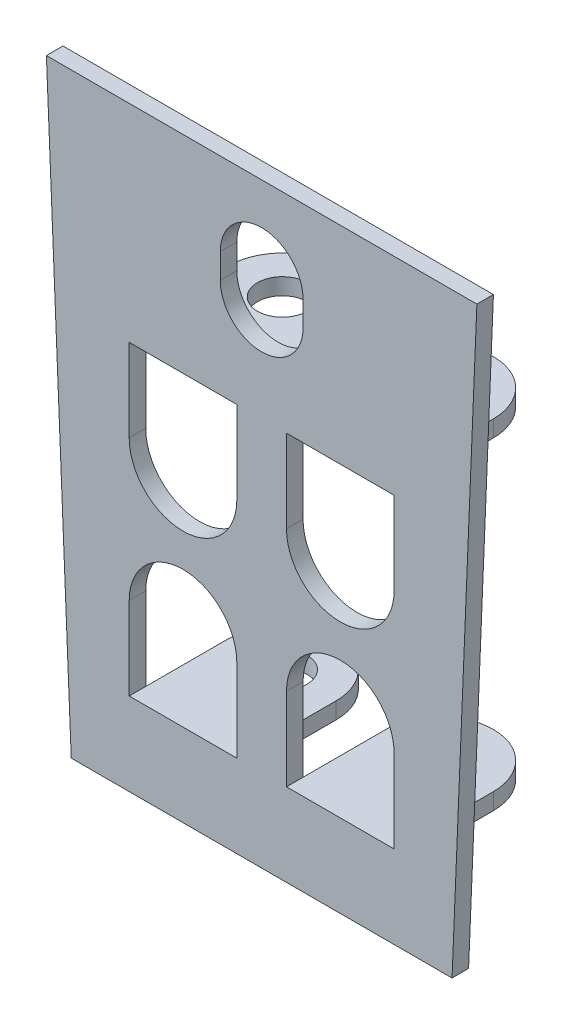
from build123d import *

# Parameters (mm, degrees)
EXTRUDE_1_DEPTH = 2
SKETCH_2_R      = 3
EXTRUDE_2_DEPTH = 2


with BuildPart() as part:
    # 草图1 → 凸台-拉伸1 (new body)
    with BuildSketch(Plane.XY):
        Polygon((-45.669718709, -55.644277912), (-48.669718709, 16.355722088), (3.330281291, 16.355722088), (0.330281291, -55.644277912), align=None)
        with BuildLine():
            ThreePointArc((-25.669718709, -35.644277912), (-32.169718709, -29.144277912), (-38.669718709, -35.644277912))
            Line((-38.669718709, -35.644277912), (-38.669718709, -45.644277912))
            Line((-38.669718709, -45.644277912), (-25.669718709, -45.644277912))
            Line((-25.669718709, -45.644277912), (-25.669718709, -35.644277912))
        make_face(mode=Mode.SUBTRACT)
        with BuildLine():
            ThreePointArc((-19.669718709, -18.644277912), (-13.169718709, -25.144277912), (-6.669718709, -18.644277912))
            Line((-6.669718709, -18.644277912), (-6.669718709, -8.644277912))
            Line((-6.669718709, -8.644277912), (-19.669718709, -8.644277912))
            Line((-19.669718709, -8.644277912), (-19.669718709, -18.644277912))
        make_face(mode=Mode.SUBTRACT)
        with BuildLine():
            ThreePointArc((-17.669718709, 6.355722088), (-22.669718709, 11.355722088), (-27.669718709, 6.355722088))
            Line((-27.669718709, 6.355722088), (-27.669718709, 3.355722088))
            ThreePointArc((-27.669718709, 3.355722088), (-22.669718709, -1.644277912), (-17.669718709, 3.355722088))
            Line((-17.669718709, 3.355722088), (-17.669718709, 6.355722088))
        make_face(mode=Mode.SUBTRACT)
        with BuildLine():
            Line((-25.669718709, -8.644277912), (-25.669718709, -18.644277912))
            ThreePointArc((-25.669718709, -18.644277912), (-32.169718709, -25.144277912), (-38.669718709, -18.644277912))
            Line((-38.669718709, -18.644277912), (-38.669718709, -8.644277912))
            Line((-38.669718709, -8.644277912), (-25.669718709, -8.644277912))
        make_face(mode=Mode.SUBTRACT)
        with BuildLine():
            Line((-19.669718709, -45.644277912), (-19.669718709, -35.644277912))
            ThreePointArc((-19.669718709, -35.644277912), (-13.169718709, -29.144277912), (-6.669718709, -35.644277912))
            Line((-6.669718709, -35.644277912), (-6.669718709, -45.644277912))
            Line((-6.669718709, -45.644277912), (-19.669718709, -45.644277912))
        make_face(mode=Mode.SUBTRACT)
    extrude(amount=EXTRUDE_1_DEPTH)

    # 草图2 → 凸台-拉伸2 (add)
    # profile 1 of 2: a face of its own
    with BuildSketch(Plane(origin=(0, -8.644277912, 0), x_dir=(-1, 0, 0), z_dir=(0, -1, 0))):
        with BuildLine():
            ThreePointArc((25.669718709, 10), (32.169718709, 16.5), (38.669718709, 10))
            Line((38.669718709, 10), (38.669718709, 0))
            Line((38.669718709, 0), (25.669718709, 0))
            Line((25.669718709, 0), (25.669718709, 10))
        make_face()
        with Locations(Location((32.169718709, 10, 0), (0, 0, 180))):
            Circle(SKETCH_2_R, mode=Mode.SUBTRACT)
    # profile 2 of 2: a face of its own
    with BuildSketch(Plane(origin=(0, -8.644277912, 0), x_dir=(-1, 0, 0), z_dir=(0, -1, 0))):
        with BuildLine():
            ThreePointArc((6.669718709, 10), (13.169718709, 16.5), (19.669718709, 10))
            Line((19.669718709, 10), (19.669718709, 0))
            Line((19.669718709, 0), (6.669718709, 0))
            Line((6.669718709, 0), (6.669718709, 10))
        make_face()
        with Locations(Location((13.169718709, 10, 0), (0, 0, 180))):
            Circle(SKETCH_2_R, mode=Mode.SUBTRACT)
    extrude_2 = extrude(amount=-EXTRUDE_2_DEPTH)

    # 镜向2: 凸台-拉伸2 across plane
    add(extrude_2.mirror(Plane(origin=(0, -27.144277912, 0), x_dir=(0, 0, 1), z_dir=(0, -1, 0))))


solid = part.part
